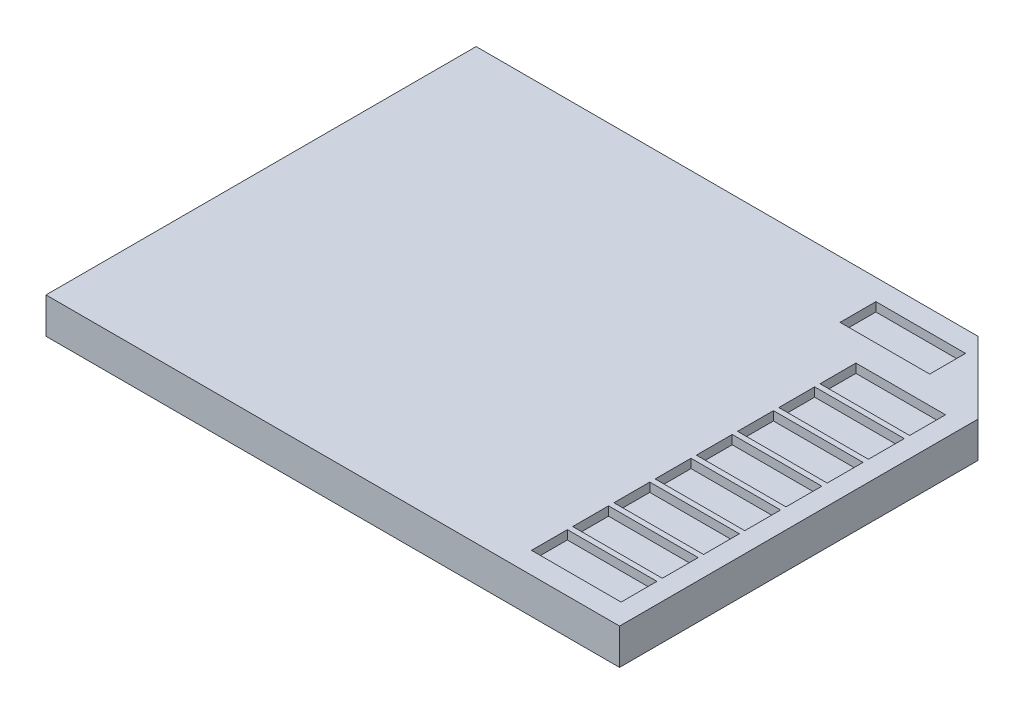
from build123d import *

# Parameters (mm, degrees)
SKETCH_1_W          = 32
SKETCH_1_H          = 24
EXTRUDE_1_DEPTH     = 2
CUT_EXTRUDE_1_DEPTH = 2
SKETCH_3_W          = 5
SKETCH_3_H          = 2
CUT_EXTRUDE_2_DEPTH = 0.5


with BuildPart() as part:
    # 草图1 → 拉伸1 (new body)
    with BuildSketch(Plane(origin=(0, 0, 0), x_dir=(1, 0, 0), z_dir=(0, 1, 0))):
        Rectangle(SKETCH_1_W, SKETCH_1_H)
    extrude(amount=EXTRUDE_1_DEPTH)

    # 草图2 → 切除-拉伸1 (cut)
    with BuildSketch(Plane(origin=(0, 2, 0), x_dir=(-1, 0, 0), z_dir=(0, 1, 0))):
        Polygon((-16, -12), (-12, -12), (-16, -8), align=None)
    extrude(amount=-CUT_EXTRUDE_1_DEPTH, mode=Mode.SUBTRACT)

    # 草图3 → 切除-拉伸2 (cut)
    with BuildSketch(Plane(origin=(0, 2, 0), x_dir=(-1, 0, 0), z_dir=(0, 1, 0))):
        with Locations((-12.385426295, 7.498304406)):
            Rectangle(SKETCH_3_W, SKETCH_3_H)
        with Locations((-12.385426295, 9.798304406)):
            Rectangle(SKETCH_3_W, SKETCH_3_H)
        with Locations((-12.385426295, 5.198304406)):
            Rectangle(SKETCH_3_W, SKETCH_3_H)
        with Locations((-12.385426295, 2.898304406)):
            Rectangle(SKETCH_3_W, SKETCH_3_H)
        with Locations((-12.385426295, 0.598304406)):
            Rectangle(SKETCH_3_W, SKETCH_3_H)
        with Locations((-12.385426295, -1.701695594)):
            Rectangle(SKETCH_3_W, SKETCH_3_H)
        with Locations((-12.385426295, -4.001695594)):
            Rectangle(SKETCH_3_W, SKETCH_3_H)
        with Locations((-12.385426295, -6.301695594)):
            Rectangle(SKETCH_3_W, SKETCH_3_H)
        with Locations((-9.977401753, -9.827028282)):
            Rectangle(SKETCH_3_W, SKETCH_3_H)
    extrude(amount=-CUT_EXTRUDE_2_DEPTH, mode=Mode.SUBTRACT)


solid = part.part
